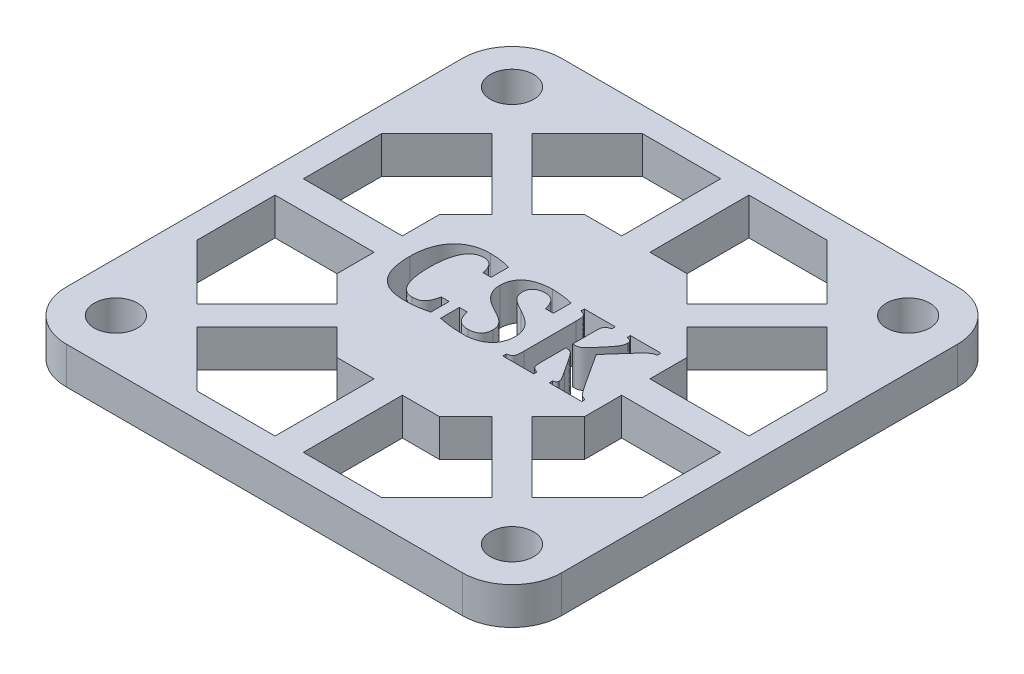
from build123d import *

# Parameters (mm, degrees)
SKETCH1_W           = 40
SKETCH1_H           = 40
BOSS_EXTRUDE1_DEPTH = 3
SKETCH2_R           = 1.75
CUT_EXTRUDE1_DEPTH  = 57.648036153
FILLET1_R           = 4
CUT_EXTRUDE2_DEPTH  = 57.648036153
CIRPATTERN1_COUNT   = 8
CUT_EXTRUDE3_DEPTH  = 57.648036153


with BuildPart() as part:
    # Sketch1 → Boss-Extrude1 (new body)
    with BuildSketch(Plane(origin=(0, 0, 0), x_dir=(1, 0, 0), z_dir=(0, 1, 0))):
        with Locations((20, 20)):
            Rectangle(SKETCH1_W, SKETCH1_H)
    extrude(amount=BOSS_EXTRUDE1_DEPTH)

    # Sketch2 → Cut-Extrude1 (cut, through all)
    with BuildSketch(Plane(origin=(0, 3, 0), x_dir=(1, 0, 0), z_dir=(0, 1, 0))):
        with Locations((4, 4)):
            Circle(SKETCH2_R)
        with Locations((36, 4)):
            Circle(SKETCH2_R)
        with Locations((36, 36)):
            Circle(SKETCH2_R)
        with Locations((4, 36)):
            Circle(SKETCH2_R)
    extrude(amount=-CUT_EXTRUDE1_DEPTH, mode=Mode.SUBTRACT)

    # Fillet1
    fillet1_edges = [part.edges().sort_by_distance(p)[0] for p in [
        (40, 1.5, -40),
        (0, 1.5, -40),
        (40, 1.5, 0),
        (0, 1.5, 0),
    ]]
    fillet(fillet1_edges, radius=FILLET1_R)

    # Sketch4 → Cut-Extrude2 (cut, through all)
    with BuildSketch(Plane(origin=(0, 3, 0), x_dir=(1, 0, 0), z_dir=(0, 1, 0))):
        Polygon((26.263455967, 27.878679656), (31.920310217, 33.535533906), (27.455844123, 38), (21.142135624, 38), (21.142135624, 30), (24.142135624, 30), align=None)
    cut_extrude2 = extrude(amount=-CUT_EXTRUDE2_DEPTH, mode=Mode.SUBTRACT)

    # CirPattern1: Cut-Extrude2 ×8 about axis
    cirpattern1_axis = Axis((20, 3.15, -20), (0, -1, 0))
    for i in range(1, CIRPATTERN1_COUNT):
        add(cut_extrude2.rotate(cirpattern1_axis, i * 360 / CIRPATTERN1_COUNT), mode=Mode.SUBTRACT)

    # Sketch5 → Cut-Extrude3 (cut, through all)
    with BuildSketch(Plane(origin=(0, 3, 0), x_dir=(1, 0, 0), z_dir=(0, 1, 0))):
        with BuildLine():
            Line((16.478509521, 23.247014427), (16.478509521, 21.830700684))
            Line((16.478509521, 21.830700684), (15.838238525, 21.830700684))
            add(Edge.make_bspline(
                [(15.838238525, 21.830700684), (15.818298588, 21.918910311), (15.780663696, 22.085398285), (15.697272691, 22.313388603), (15.599018839, 22.506289438), (15.4797306, 22.661732288), (15.342939887, 22.783544283), (15.184464899, 22.867260975), (15.007302753, 22.919298555), (14.882494871, 22.925232517), (14.817806625, 22.928308105)],
                knots=[0, 0, 0, 0, 1.318127866, 2.487851341, 3.532388156, 4.463771388, 5.33069343, 6.18266645, 7.058071352, 8, 8, 8, 8], degree=3))
            add(Edge.make_bspline(
                [(14.817806625, 22.928308105), (14.756195372, 22.926195079), (14.635780871, 22.922065329), (14.460713939, 22.887251036), (14.298267882, 22.828104982), (14.146705351, 22.746822125), (14.007413936, 22.641761766), (13.880989898, 22.512034141), (13.764552744, 22.361462481), (13.662127763, 22.186513067), (13.570423402, 21.989985043), (13.492935292, 21.770365435), (13.425859921, 21.529205753), (13.370368603, 21.265749797), (13.328050647, 20.979839675), (13.298991622, 20.671645961), (13.279757704, 20.34174391), (13.278039854, 20.114288956), (13.277154541, 19.997067451)],
                knots=[0, 0, 0, 0, 0.800637129, 1.564784294, 2.309424377, 3.041120442, 3.793144549, 4.568458655, 5.389936813, 6.262142842, 7.198837598, 8.205987069, 9.2866366, 10.45176285, 11.704540913, 13.042715489, 14.475929707, 16, 16, 16, 16], degree=3))
            add(Edge.make_bspline(
                [(13.277154541, 19.997067451), (13.27814479, 19.887946563), (13.280066054, 19.676232129), (13.297865771, 19.369245454), (13.324063572, 19.082535932), (13.362403598, 18.816282185), (13.411777039, 18.570342055), (13.472895589, 18.344762075), (13.545882417, 18.139928271), (13.627865682, 17.954532608), (13.722176398, 17.790226755), (13.827920708, 17.648362899), (13.94318746, 17.527075928), (14.070731034, 17.428883365), (14.20807669, 17.351025994), (14.356528598, 17.295658094), (14.515412813, 17.2643232), (14.624732291, 17.259699572), (14.680605698, 17.257336426)],
                knots=[0, 0, 0, 0, 1.530055377, 2.968586589, 4.310691247, 5.566277377, 6.738862084, 7.826318781, 8.840559143, 9.785434891, 10.66542987, 11.491134013, 12.261241907, 13.004184338, 13.740004402, 14.467160996, 15.216562878, 16, 16, 16, 16], degree=3))
            add(Edge.make_bspline(
                [(14.680605698, 17.257336426), (14.736474689, 17.258226973), (14.843560101, 17.259933906), (14.995555424, 17.286040251), (15.133202618, 17.32078907), (15.254287214, 17.376818803), (15.361274163, 17.447770978), (15.456872768, 17.533583104), (15.54205766, 17.63395959), (15.614044128, 17.753439487), (15.678823545, 17.892083734), (15.738433229, 18.054149711), (15.791921306, 18.241681324), (15.822249892, 18.375738717), (15.838238525, 18.446411133)],
                knots=[0, 0, 0, 0, 1.08733336, 2.084117472, 2.998628386, 3.846209617, 4.670273846, 5.492243082, 6.342261939, 7.226091871, 8.202118753, 9.321449096, 10.58792076, 12, 12, 12, 12], degree=3))
            Line((15.838238525, 18.446411133), (16.478509521, 18.446411133))
            Line((16.478509521, 18.446411133), (16.478509521, 16.954351044))
            add(Edge.make_bspline(
                [(16.478509521, 16.954351044), (16.391927331, 16.933790471), (16.223527409, 16.893800736), (15.974919043, 16.844417284), (15.738274122, 16.800966139), (15.43542201, 16.754745937), (15.056503332, 16.716067488), (14.752171848, 16.711069408), (14.59771347, 16.708532715)],
                knots=[0, 0, 0, 0, 0.842330336, 1.638308791, 2.399040171, 3.119740717, 4.538172354, 6, 6, 6, 6], degree=3))
            add(Edge.make_bspline(
                [(14.59771347, 16.708532715), (14.516218673, 16.709588683), (14.356377605, 16.711659822), (14.122612011, 16.729068609), (13.900154362, 16.757113749), (13.689495555, 16.797906278), (13.489165089, 16.84619505), (13.301631846, 16.910361091), (13.124459755, 16.982338043), (12.959803615, 17.068655818), (12.805985093, 17.166337838), (12.662499531, 17.275285357), (12.529199509, 17.395845508), (12.405791682, 17.527366376), (12.294095779, 17.671345106), (12.1924538, 17.826244789), (12.100659612, 17.992267661), (12.02052246, 18.170769292), (11.951092412, 18.361208107), (11.889626449, 18.563502503), (11.836303754, 18.777456948), (11.795811912, 19.00443574), (11.763075233, 19.242841403), (11.738679768, 19.493579986), (11.724266633, 19.756316748), (11.722905354, 19.935594609), (11.722210693, 20.027080154)],
                knots=[0, 0, 0, 0, 1.159635603, 2.274469046, 3.334025084, 4.348550157, 5.326911197, 6.263802524, 7.166539045, 8.045934427, 8.905452706, 9.756992785, 10.606614522, 11.460418623, 12.320230969, 13.196484709, 14.094678295, 15.017108075, 15.978048831, 16.977442302, 18.024869283, 19.113946258, 20.256833539, 21.448855471, 22.698150198, 24, 24, 24, 24], degree=3))
            add(Edge.make_bspline(
                [(11.722210693, 20.027080154), (11.723235605, 20.113340294), (11.725253537, 20.283176561), (11.743362119, 20.533471937), (11.769708436, 20.775405348), (11.808380393, 21.008704494), (11.85814534, 21.233527297), (11.919997958, 21.44945043), (11.991080921, 21.65736511), (12.073824123, 21.856122543), (12.167998674, 22.044704595), (12.272964882, 22.222537653), (12.386772177, 22.390671206), (12.513271522, 22.545791426), (12.647706804, 22.692233827), (12.795396796, 22.824039808), (12.952191416, 22.94668339), (13.118993165, 23.058261224), (13.296277334, 23.156255695), (13.481787309, 23.242875421), (13.675757105, 23.315643562), (13.879121327, 23.373882867), (14.089866364, 23.421440632), (14.309583992, 23.45418273), (14.537376418, 23.472403093), (14.6920075, 23.475524468), (14.770643806, 23.477111816)],
                knots=[0, 0, 0, 0, 1.190524674, 2.344005795, 3.462330608, 4.5488043, 5.606560518, 6.638994431, 7.647593623, 8.638022267, 9.608493659, 10.554712121, 11.486748705, 12.407958682, 13.315263161, 14.22781888, 15.136766144, 16.061443204, 16.994592612, 17.930148599, 18.885282262, 19.850884627, 20.848014252, 21.865428304, 22.91448194, 24, 24, 24, 24], degree=3))
            add(Edge.make_bspline(
                [(14.770643806, 23.477111816), (14.85021348, 23.476710452), (15.005133083, 23.475929009), (15.232017358, 23.465591577), (15.447083797, 23.449064802), (15.722179693, 23.415457058), (16.067287893, 23.357891279), (16.338987447, 23.284633481), (16.478509521, 23.247014427)],
                knots=[0, 0, 0, 0, 0.82813278, 1.612347977, 2.363445611, 3.072583796, 4.496724877, 6, 6, 6, 6], degree=3))
        make_face()
        with BuildLine():
            add(Edge.make_bspline(
                [(17.941986084, 18.446411133), (17.952386534, 18.397685945), (17.972610654, 18.302937727), (18.011325913, 18.166915856), (18.055609587, 18.041050606), (18.104534801, 17.924732597), (18.156905254, 17.816451031), (18.216506537, 17.718522275), (18.281763404, 17.630641227), (18.350085718, 17.550776384), (18.42712192, 17.48076973), (18.513286005, 17.421623938), (18.606204171, 17.36862606), (18.709127914, 17.330276401), (18.818398266, 17.295767162), (18.93700744, 17.274463331), (19.063486482, 17.259118458), (19.150540285, 17.257942206), (19.195373726, 17.257336426)],
                knots=[0, 0, 0, 0, 1.24886554, 2.428472656, 3.54284518, 4.592074114, 5.590943775, 6.555741489, 7.461117158, 8.333021556, 9.187072751, 10.061835725, 10.949308179, 11.860886467, 12.809279934, 13.81887478, 14.876702152, 16, 16, 16, 16], degree=3))
            add(Edge.make_bspline(
                [(19.195373726, 17.257336426), (19.242604056, 17.25825598), (19.335069266, 17.260056239), (19.469522327, 17.279321571), (19.596994047, 17.309284549), (19.717105408, 17.35135323), (19.828051079, 17.408673706), (19.927785376, 17.480914587), (20.01623227, 17.567884198), (20.09213192, 17.669878081), (20.154310116, 17.786606382), (20.198400415, 17.917849114), (20.224227676, 18.062853988), (20.227148693, 18.16380093), (20.228668213, 18.216313744)],
                knots=[0, 0, 0, 0, 1.062149491, 2.079423874, 3.049276155, 4.005464921, 4.935640425, 5.849110802, 6.766347565, 7.716145188, 8.699237381, 9.729811501, 10.819043139, 12, 12, 12, 12], degree=3))
            add(Edge.make_bspline(
                [(20.228668213, 18.216313744), (20.227475364, 18.265487117), (20.225169996, 18.360522444), (20.202310872, 18.497792854), (20.169846367, 18.625886185), (20.117597945, 18.743735484), (20.052465741, 18.85584017), (19.969888544, 18.963348389), (19.870521955, 19.067947219), (19.752285931, 19.170508613), (19.614254938, 19.273659163), (19.452202691, 19.377905079), (19.26720005, 19.486615532), (19.132879615, 19.555216432), (19.062460327, 19.591181374)],
                knots=[0, 0, 0, 0, 0.922451525, 1.782783555, 2.607354513, 3.396673273, 4.194462227, 5.037127191, 5.935674212, 6.899196258, 7.972633037, 9.168530523, 10.515564188, 12, 12, 12, 12], degree=3))
            add(Edge.make_bspline(
                [(19.062460327, 19.591181374), (18.941262489, 19.654247788), (18.706846402, 19.776228364), (18.4279793, 19.943347581), (18.225817055, 20.08394124), (18.089084684, 20.193589907), (17.962971153, 20.307582193), (17.848290398, 20.427940539), (17.745360447, 20.553433442), (17.654182042, 20.684671303), (17.576059483, 20.821555089), (17.508761686, 20.964308107), (17.457106967, 21.115766696), (17.420695761, 21.275767115), (17.396563064, 21.444570715), (17.394327766, 21.560023345), (17.393182373, 21.619182587)],
                knots=[0, 0, 0, 0, 2.058134337, 3.980762403, 4.892704019, 5.765863431, 6.619423588, 7.451965296, 8.268009496, 9.062367096, 9.856432837, 10.63991927, 11.43657556, 12.261784146, 13.10931842, 14, 14, 14, 14], degree=3))
            add(Edge.make_bspline(
                [(17.393182373, 21.619182587), (17.393848015, 21.66781315), (17.395156239, 21.763389515), (17.410140801, 21.903747806), (17.433089596, 22.038805083), (17.463563813, 22.168723381), (17.506133766, 22.292509218), (17.555391784, 22.41091212), (17.614825144, 22.523701042), (17.706143794, 22.666490331), (17.84420206, 22.830892955), (18.040281214, 23.004812129), (18.271548658, 23.14935919), (18.532293623, 23.26839579), (18.820068191, 23.36233435), (19.131100412, 23.427814615), (19.463317301, 23.471195558), (19.692105313, 23.47510081), (19.809919548, 23.477111816)],
                knots=[0, 0, 0, 0, 0.677609128, 1.331743105, 1.964914122, 2.586594663, 3.189259492, 3.787407713, 4.372550753, 4.963840737, 6.147333873, 7.351712002, 8.602533565, 9.93358942, 11.338413031, 12.812781261, 14.358743813, 16, 16, 16, 16], degree=3))
            add(Edge.make_bspline(
                [(19.809919548, 23.477111816), (19.948618978, 23.475074059), (20.220306101, 23.47108246), (20.558847865, 23.4405827), (20.829254396, 23.401190224), (21.044647942, 23.366503025), (21.2723932, 23.317997326), (21.428745736, 23.28245557), (21.509210205, 23.264164543)],
                knots=[0, 0, 0, 0, 1.453975289, 2.848074876, 3.559361539, 4.318884407, 5.134839269, 6, 6, 6, 6], degree=3))
            Line((21.509210205, 23.264164543), (21.509210205, 21.830700684))
            Line((21.509210205, 21.830700684), (20.868939209, 21.830700684))
            add(Edge.make_bspline(
                [(20.868939209, 21.830700684), (20.852997322, 21.894258816), (20.822539375, 22.015690503), (20.767533111, 22.186210137), (20.704548206, 22.335741215), (20.635673036, 22.466172522), (20.560072204, 22.579294764), (20.474228906, 22.67520906), (20.380112153, 22.756020894), (20.274690846, 22.820154084), (20.158425406, 22.868689786), (20.029582619, 22.905307096), (19.886213503, 22.924013308), (19.786145591, 22.926840002), (19.734173203, 22.928308105)],
                knots=[0, 0, 0, 0, 1.351731927, 2.582566266, 3.692476948, 4.695010811, 5.621889774, 6.491999059, 7.342740843, 8.172092804, 9.026460568, 9.93507645, 10.927538234, 12, 12, 12, 12], degree=3))
            add(Edge.make_bspline(
                [(19.734173203, 22.928308105), (19.689333955, 22.927326437), (19.601157181, 22.925395977), (19.472592607, 22.906810465), (19.351237283, 22.874568057), (19.23751198, 22.832901386), (19.133041982, 22.777950749), (19.039617757, 22.711092667), (18.959019495, 22.630567433), (18.887661392, 22.541325823), (18.833871546, 22.438070286), (18.792838028, 22.325903904), (18.77053712, 22.202672856), (18.767010985, 22.117570051), (18.76519165, 22.07366066)],
                knots=[0, 0, 0, 0, 1.107629715, 2.178163535, 3.2004193, 4.206274177, 5.164714652, 6.109024293, 7.033082865, 7.972684172, 8.920729027, 9.896367773, 10.914616141, 12, 12, 12, 12], degree=3))
            add(Edge.make_bspline(
                [(18.76519165, 22.07366066), (18.766602111, 22.027856944), (18.769334475, 21.939125393), (18.789346592, 21.810381113), (18.823769505, 21.691438487), (18.871369945, 21.579650877), (18.93785761, 21.474869228), (19.022199452, 21.37356028), (19.122661889, 21.271156013), (19.245031207, 21.170110388), (19.392798903, 21.068512215), (19.565220923, 20.958267437), (19.768216868, 20.842915003), (19.914037992, 20.765566751), (19.991424942, 20.724518204)],
                knots=[0, 0, 0, 0, 0.851659455, 1.649845737, 2.415303784, 3.149355668, 3.90157415, 4.713797267, 5.597124304, 6.565846922, 7.659620595, 8.930263842, 10.370897766, 12, 12, 12, 12], degree=3))
            add(Edge.make_bspline(
                [(19.991424942, 20.724518204), (20.086252707, 20.673968561), (20.267681712, 20.577254572), (20.519476926, 20.424665649), (20.739338494, 20.27328504), (20.929004537, 20.122393508), (21.091952419, 19.968817255), (21.231951619, 19.810606904), (21.346923908, 19.64302917), (21.441546843, 19.468577608), (21.513409253, 19.283128735), (21.56539649, 19.085280866), (21.595218987, 18.872742066), (21.598824112, 18.72614713), (21.60067749, 18.650783348)],
                knots=[0, 0, 0, 0, 1.386425634, 2.652575677, 3.796756148, 4.828782941, 5.776721465, 6.682879846, 7.549083738, 8.393417515, 9.238153984, 10.108904681, 11.02779659, 12, 12, 12, 12], degree=3))
            add(Edge.make_bspline(
                [(21.60067749, 18.650783348), (21.597653837, 18.554292207), (21.591784677, 18.366994985), (21.538373334, 18.095804664), (21.453604102, 17.84386791), (21.332067531, 17.613510081), (21.179478065, 17.404796233), (20.992904774, 17.222526952), (20.775557737, 17.064573189), (20.527617401, 16.936456913), (20.255812615, 16.83318924), (19.961553818, 16.761312358), (19.647468431, 16.715749504), (19.430875798, 16.710980403), (19.319712067, 16.708532715)],
                knots=[0, 0, 0, 0, 1.025848756, 1.991256615, 2.929118134, 3.845229946, 4.751696722, 5.669406184, 6.609402694, 7.600361286, 8.630410259, 9.69642111, 10.817714058, 12, 12, 12, 12], degree=3))
            add(Edge.make_bspline(
                [(19.319712067, 16.708532715), (19.152895201, 16.711551995), (18.811635134, 16.717728586), (18.298787325, 16.760051886), (17.791434058, 16.826102255), (17.46188986, 16.8960547), (17.301715088, 16.930055046)],
                knots=[0, 0, 0, 0, 0.984094478, 2.013178619, 3.034306584, 4, 4, 4, 4], degree=3))
            Line((17.301715088, 16.930055046), (17.301715088, 18.446411133))
            Line((17.301715088, 18.446411133), (17.941986084, 18.446411133))
        make_face()
        with BuildLine():
            add(Edge.make_bspline(
                [(27.834744644, 18.051958466), (27.865204902, 18.005729379), (27.92307181, 17.917905621), (28.005884622, 17.79318995), (28.08109186, 17.683214073), (28.16869001, 17.562794085), (28.265481984, 17.43921598), (28.371941059, 17.317165703), (28.473419938, 17.228544465), (28.57554145, 17.16002948), (28.693629886, 17.109113338), (28.779597686, 17.082974345), (28.826593018, 17.06868515)],
                knots=[0, 0, 0, 0, 1.157562726, 2.199081047, 3.130195911, 3.943090728, 5.31208529, 6.41229926, 7.323106242, 8.121530652, 8.973112157, 10, 10, 10, 10], degree=3))
            Line((28.826593018, 17.06868515), (28.826593018, 16.8))
            Line((28.826593018, 16.8), (26.212629509, 16.8))
            Line((26.212629509, 16.8), (26.212629509, 17.074401855))
            add(Edge.make_bspline(
                [(26.212629509, 17.074401855), (26.238022152, 17.078547734), (26.284564126, 17.086146682), (26.346606923, 17.105172648), (26.396647562, 17.12562306), (26.445030463, 17.159746462), (26.485938317, 17.219759472), (26.490433784, 17.27475707), (26.49274807, 17.303070068)],
                knots=[0, 0, 0, 0, 1.151019885, 2.109695205, 2.902758418, 3.560180175, 4.743970303, 6, 6, 6, 6], degree=3))
            add(Edge.make_bspline(
                [(26.49274807, 17.303070068), (26.491705294, 17.328908133), (26.489616014, 17.380676626), (26.473498527, 17.445778921), (26.455546087, 17.502359945), (26.430892257, 17.552519833), (26.401671459, 17.612722601), (26.360205681, 17.684696146), (26.304886369, 17.777074412), (26.231177165, 17.896900796), (26.132621506, 18.045309802), (26.060609756, 18.15482727), (26.021119881, 18.214884567)],
                knots=[0, 0, 0, 0, 0.745061087, 1.492785606, 1.927906461, 2.45743263, 3.103554135, 3.861339309, 4.85480703, 6.214168036, 7.923921714, 10, 10, 10, 10], degree=3))
            Line((26.021119881, 18.214884567), (25.260798073, 19.363942337))
            add(Edge.make_bspline(
                [(25.260798073, 19.363942337), (25.238510257, 19.396883362), (25.195926226, 19.459821859), (25.134242142, 19.547564428), (25.076133199, 19.623453834), (25.006965299, 19.705250541), (24.926578614, 19.790122097), (24.835923222, 19.851767494), (24.759229896, 19.883622493), (24.693100458, 19.898687097), (24.617989085, 19.908862225), (24.564352633, 19.909534765), (24.536205673, 19.909887695)],
                knots=[0, 0, 0, 0, 1.245053671, 2.378851453, 3.357232014, 4.235594611, 5.733019442, 7.002835127, 7.631494504, 8.322348928, 9.119614106, 10, 10, 10, 10], degree=3))
            Line((24.536205673, 19.909887695), (24.43616333, 19.909887695))
            Line((24.43616333, 19.909887695), (24.43616333, 17.97621212))
            add(Edge.make_bspline(
                [(24.43616333, 17.97621212), (24.43682674, 17.921419729), (24.438107988, 17.815598678), (24.444530291, 17.665334629), (24.456739983, 17.533992139), (24.480451413, 17.424427371), (24.516418572, 17.335318669), (24.566881804, 17.261217498), (24.636496882, 17.201289261), (24.724214769, 17.149079389), (24.834092692, 17.107902006), (24.914737509, 17.086065492), (24.957812691, 17.074401855)],
                knots=[0, 0, 0, 0, 1.397170186, 2.698367697, 3.834594448, 4.756922584, 5.546508072, 6.270990296, 7.019514934, 7.869490627, 8.862021364, 10, 10, 10, 10], degree=3))
            Line((24.957812691, 17.074401855), (24.957812691, 16.8))
            Line((24.957812691, 16.8), (22.456754112, 16.8))
            Line((22.456754112, 16.8), (22.456754112, 17.074401855))
            add(Edge.make_bspline(
                [(22.456754112, 17.074401855), (22.51048982, 17.089918611), (22.606863473, 17.117747526), (22.734814582, 17.171563682), (22.833187993, 17.241302565), (22.899171288, 17.337841923), (22.94168314, 17.455666527), (22.96146593, 17.601142573), (22.97215353, 17.77831074), (22.972496977, 17.908536343), (22.972686768, 17.980499649)],
                knots=[0, 0, 0, 0, 1.138562446, 2.041983393, 2.81822272, 3.555905379, 4.384929344, 5.348412468, 6.534719759, 8, 8, 8, 8], degree=3))
            Line((22.972686768, 17.980499649), (22.972686768, 22.200857353))
            add(Edge.make_bspline(
                [(22.972686768, 22.200857353), (22.972357448, 22.271394616), (22.971756241, 22.400167777), (22.962363579, 22.576700931), (22.945413415, 22.722482568), (22.90254614, 22.84036612), (22.837681738, 22.937230756), (22.738311766, 23.008281779), (22.610231172, 23.067655006), (22.511627351, 23.09565861), (22.456754112, 23.111242676)],
                knots=[0, 0, 0, 0, 1.43212336, 2.614491164, 3.592878272, 4.398050805, 5.141564571, 5.921458422, 6.843287133, 8, 8, 8, 8], degree=3))
            Line((22.456754112, 23.111242676), (22.456754112, 23.385644531))
            Line((22.456754112, 23.385644531), (24.957812691, 23.385644531))
            Line((24.957812691, 23.385644531), (24.957812691, 23.111242676))
            add(Edge.make_bspline(
                [(24.957812691, 23.111242676), (24.926201719, 23.102721696), (24.866631974, 23.086664214), (24.785886768, 23.056320751), (24.717497251, 23.026852441), (24.647178023, 22.986461491), (24.576885588, 22.928422847), (24.515226648, 22.841582099), (24.477686266, 22.735216777), (24.455362655, 22.633378403), (24.444993484, 22.533542528), (24.439606767, 22.438173262), (24.437267346, 22.325206056), (24.436548225, 22.244209236), (24.43616333, 22.200857353)],
                knots=[0, 0, 0, 0, 0.997876128, 1.880461812, 2.628401592, 3.266367116, 4.349065608, 5.381052737, 6.471135116, 7.764974268, 8.554382902, 9.529577064, 10.677756903, 12, 12, 12, 12], degree=3))
            Line((24.43616333, 22.200857353), (24.43616333, 20.458691406))
            Line((24.43616333, 20.458691406), (24.540493202, 20.458691406))
            add(Edge.make_bspline(
                [(24.540493202, 20.458691406), (24.576261468, 20.458984571), (24.644145221, 20.45954096), (24.739494465, 20.470401211), (24.824036071, 20.483542026), (24.92422404, 20.512871679), (25.044517031, 20.57570085), (25.144204578, 20.655649506), (25.217257413, 20.722774259), (25.263774662, 20.772056787), (25.319592365, 20.830559134), (25.384299728, 20.898855538), (25.455079852, 20.979467495), (25.535708419, 21.069452564), (25.62376209, 21.170526863), (25.747544956, 21.314945923), (25.895976189, 21.489143865), (26.057069759, 21.681394142), (26.187780055, 21.8487105), (26.295398918, 21.989730187), (26.380626412, 22.112867737), (26.449258546, 22.222578127), (26.504281737, 22.321092202), (26.557520084, 22.436139621), (26.60182705, 22.573992444), (26.609210784, 22.685479915), (26.612798882, 22.73965683)],
                knots=[0, 0, 0, 0, 0.793841827, 1.506613776, 2.12935454, 2.691831104, 3.818027523, 5.115372954, 5.519664613, 6.020997883, 6.619725123, 7.315890061, 8.11022533, 9.002092945, 9.999441746, 11.087413123, 13.226644998, 15.082632488, 16.657465926, 17.94197634, 19.022047111, 19.982104979, 20.815573586, 21.525749193, 22.797647172, 24, 24, 24, 24], degree=3))
            add(Edge.make_bspline(
                [(26.612798882, 22.73965683), (26.611602137, 22.766979908), (26.609313586, 22.819230189), (26.586950079, 22.892938728), (26.550896282, 22.957401212), (26.499335345, 23.011242964), (26.435420352, 23.053480694), (26.360902003, 23.088474048), (26.272819269, 23.104837028), (26.210759341, 23.109044183), (26.178329277, 23.111242676)],
                knots=[0, 0, 0, 0, 1.015435912, 1.941831408, 2.839917499, 3.743771255, 4.688846298, 5.681700207, 6.7885482, 8, 8, 8, 8], degree=3))
            Line((26.178329277, 23.111242676), (26.178329277, 23.385644531))
            Line((26.178329277, 23.385644531), (28.643658447, 23.385644531))
            Line((28.643658447, 23.385644531), (28.643658447, 23.101238441))
            add(Edge.make_bspline(
                [(28.643658447, 23.101238441), (28.586031671, 23.08864261), (28.47701376, 23.064813909), (28.34821476, 23.012793757), (28.254725602, 22.957532079), (28.181243417, 22.906853969), (28.103284865, 22.845411686), (28.018956976, 22.772384369), (27.926248309, 22.685818995), (27.825094726, 22.580121484), (27.711044941, 22.457838662), (27.632091015, 22.369194946), (27.590355492, 22.322337341)],
                knots=[0, 0, 0, 0, 1.320738776, 2.4985639, 3.091912414, 3.752368119, 4.49781032, 5.315461738, 6.252168688, 7.339496738, 8.593641896, 10, 10, 10, 10], degree=3))
            Line((27.590355492, 22.322337341), (26.128308105, 20.675926208))
            Line((26.128308105, 20.675926208), (27.834744644, 18.051958466))
        make_face()
    extrude(amount=-CUT_EXTRUDE3_DEPTH, mode=Mode.SUBTRACT)


solid = part.part
